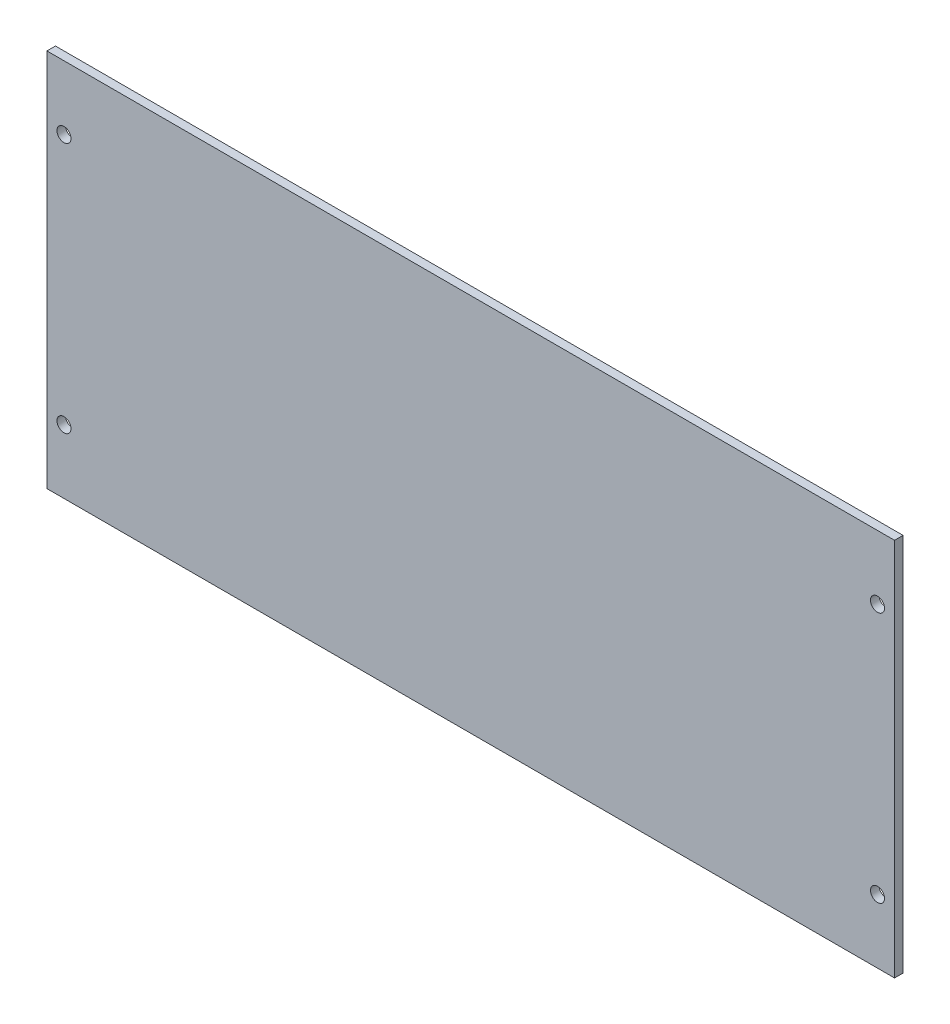
from build123d import *

# Parameters (mm, degrees)
ESQUISSE1_W        = 398
ESQUISSE1_H        = 178
BOSS_EXTRU_1_DEPTH = 4
D_GAGEMENT_M61_D   = 6.6


with BuildPart() as part:
    # Esquisse1 → Boss.-Extru.1 (new body)
    with BuildSketch(Plane.XY):
        Rectangle(ESQUISSE1_W, ESQUISSE1_H)
    extrude(amount=BOSS_EXTRU_1_DEPTH)

    # Dégagement M61 (through all)
    with Locations(Plane(origin=(0, 0, 0), x_dir=(-1, 0, 0), z_dir=(0, 0, -1))):
        with Locations((191, 59), (-191, 59), (191, -59), (-191, -59)):
            Hole(D_GAGEMENT_M61_D / 2)


solid = part.part
